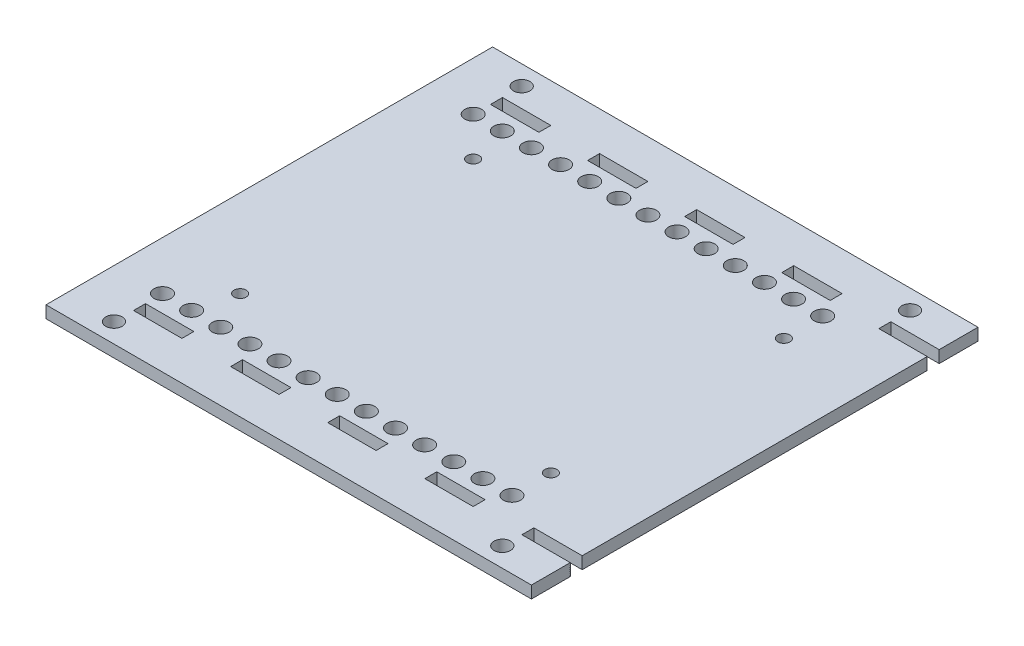
from build123d import *

# Parameters (mm, degrees)
SKETCH1_R           = 2.15265
SKETCH1_W           = 12.6492
SKETCH1_H           = 3.1242
SKETCH1_R_2         = 2.2225
SKETCH1_R_3         = 1.5875
BOSS_EXTRUDE1_DEPTH = 3.175


with BuildPart() as part:
    # Sketch1 → Boss-Extrude1 (new body)
    with BuildSketch(Plane(origin=(0, 0, 0), x_dir=(1, 0, 0), z_dir=(0, 1, 0))):
        Polygon((63.5, 45.1358), (50.8508, 45.1358), (50.8508, 48.26), (63.5, 48.26), (63.5, 58.42), (-63.5, 58.42), (-63.5, -58.42), (63.5, -58.42), (63.5, -48.26), (50.8508, -48.26), (50.8508, -45.1358), (63.5, -45.1358), align=None)
        with Locations(Location((-50.8, -53.34, 0), (0, 0, 270))):
            Circle(SKETCH1_R, mode=Mode.SUBTRACT)
        with Locations((-44.4246, -46.6979)):
            Rectangle(SKETCH1_W, SKETCH1_H, mode=Mode.SUBTRACT)
        with Locations(Location((-50.8, -40.64, 0), (0, 0, 270))):
            Circle(SKETCH1_R_2, mode=Mode.SUBTRACT)
        with Locations(Location((-43.18, -40.64, 0), (0, 0, 270))):
            Circle(SKETCH1_R_2, mode=Mode.SUBTRACT)
        with Locations(Location((-40.64, -30.48, 0), (0, 0, 270))):
            Circle(SKETCH1_R_3, mode=Mode.SUBTRACT)
        with Locations(Location((-35.56, -40.64, 0), (0, 0, 270))):
            Circle(SKETCH1_R_2, mode=Mode.SUBTRACT)
        with Locations(Location((-27.94, -40.64, 0), (0, 0, 270))):
            Circle(SKETCH1_R_2, mode=Mode.SUBTRACT)
        with Locations((-19.0246, -46.6979)):
            Rectangle(SKETCH1_W, SKETCH1_H, mode=Mode.SUBTRACT)
        with Locations(Location((-20.32, -40.64, 0), (0, 0, 270))):
            Circle(SKETCH1_R_2, mode=Mode.SUBTRACT)
        with Locations(Location((-12.7, -40.64, 0), (0, 0, 270))):
            Circle(SKETCH1_R_2, mode=Mode.SUBTRACT)
        with Locations(Location((-5.08, -40.64, 0), (0, 0, 270))):
            Circle(SKETCH1_R_2, mode=Mode.SUBTRACT)
        with Locations((6.3754, -46.6979)):
            Rectangle(SKETCH1_W, SKETCH1_H, mode=Mode.SUBTRACT)
        with Locations(Location((2.54, -40.64, 0), (0, 0, 270))):
            Circle(SKETCH1_R_2, mode=Mode.SUBTRACT)
        with Locations(Location((10.16, -40.64, 0), (0, 0, 270))):
            Circle(SKETCH1_R_2, mode=Mode.SUBTRACT)
        with Locations(Location((17.78, -40.64, 0), (0, 0, 270))):
            Circle(SKETCH1_R_2, mode=Mode.SUBTRACT)
        with Locations(Location((25.4, -40.64, 0), (0, 0, 270))):
            Circle(SKETCH1_R_2, mode=Mode.SUBTRACT)
        with Locations((31.7754, -46.6979)):
            Rectangle(SKETCH1_W, SKETCH1_H, mode=Mode.SUBTRACT)
        with Locations(Location((50.8, -53.34, 0), (0, 0, 270))):
            Circle(SKETCH1_R, mode=Mode.SUBTRACT)
        with Locations(Location((33.02, -40.64, 0), (0, 0, 270))):
            Circle(SKETCH1_R_2, mode=Mode.SUBTRACT)
        with Locations(Location((40.64, -40.64, 0), (0, 0, 270))):
            Circle(SKETCH1_R_2, mode=Mode.SUBTRACT)
        with Locations(Location((40.64, -30.48, 0), (0, 0, 270))):
            Circle(SKETCH1_R_3, mode=Mode.SUBTRACT)
        with Locations(Location((-40.64, 30.48, 0), (0, 0, 270))):
            Circle(SKETCH1_R_3, mode=Mode.SUBTRACT)
        with Locations(Location((-50.8, 40.64, 0), (0, 0, 270))):
            Circle(SKETCH1_R_2, mode=Mode.SUBTRACT)
        with Locations(Location((-43.18, 40.64, 0), (0, 0, 270))):
            Circle(SKETCH1_R_2, mode=Mode.SUBTRACT)
        with Locations(Location((-35.56, 40.64, 0), (0, 0, 270))):
            Circle(SKETCH1_R_2, mode=Mode.SUBTRACT)
        with Locations(Location((-27.94, 40.64, 0), (0, 0, 270))):
            Circle(SKETCH1_R_2, mode=Mode.SUBTRACT)
        with Locations((-44.4246, 46.6979)):
            Rectangle(SKETCH1_W, SKETCH1_H, mode=Mode.SUBTRACT)
        with Locations(Location((-50.8, 53.34, 0), (0, 0, 270))):
            Circle(SKETCH1_R, mode=Mode.SUBTRACT)
        with Locations(Location((-20.32, 40.64, 0), (0, 0, 270))):
            Circle(SKETCH1_R_2, mode=Mode.SUBTRACT)
        with Locations(Location((-12.7, 40.64, 0), (0, 0, 270))):
            Circle(SKETCH1_R_2, mode=Mode.SUBTRACT)
        with Locations(Location((-5.08, 40.64, 0), (0, 0, 270))):
            Circle(SKETCH1_R_2, mode=Mode.SUBTRACT)
        with Locations((-19.0246, 46.6979)):
            Rectangle(SKETCH1_W, SKETCH1_H, mode=Mode.SUBTRACT)
        with Locations(Location((2.54, 40.64, 0), (0, 0, 270))):
            Circle(SKETCH1_R_2, mode=Mode.SUBTRACT)
        with Locations(Location((10.16, 40.64, 0), (0, 0, 270))):
            Circle(SKETCH1_R_2, mode=Mode.SUBTRACT)
        with Locations(Location((17.78, 40.64, 0), (0, 0, 270))):
            Circle(SKETCH1_R_2, mode=Mode.SUBTRACT)
        with Locations(Location((25.4, 40.64, 0), (0, 0, 270))):
            Circle(SKETCH1_R_2, mode=Mode.SUBTRACT)
        with Locations((6.3754, 46.6979)):
            Rectangle(SKETCH1_W, SKETCH1_H, mode=Mode.SUBTRACT)
        with Locations(Location((33.02, 40.64, 0), (0, 0, 270))):
            Circle(SKETCH1_R_2, mode=Mode.SUBTRACT)
        with Locations(Location((40.64, 30.48, 0), (0, 0, 270))):
            Circle(SKETCH1_R_3, mode=Mode.SUBTRACT)
        with Locations(Location((40.64, 40.64, 0), (0, 0, 270))):
            Circle(SKETCH1_R_2, mode=Mode.SUBTRACT)
        with Locations((31.7754, 46.6979)):
            Rectangle(SKETCH1_W, SKETCH1_H, mode=Mode.SUBTRACT)
        with Locations(Location((50.8, 53.34, 0), (0, 0, 270))):
            Circle(SKETCH1_R, mode=Mode.SUBTRACT)
    extrude(amount=BOSS_EXTRUDE1_DEPTH)


solid = part.part
